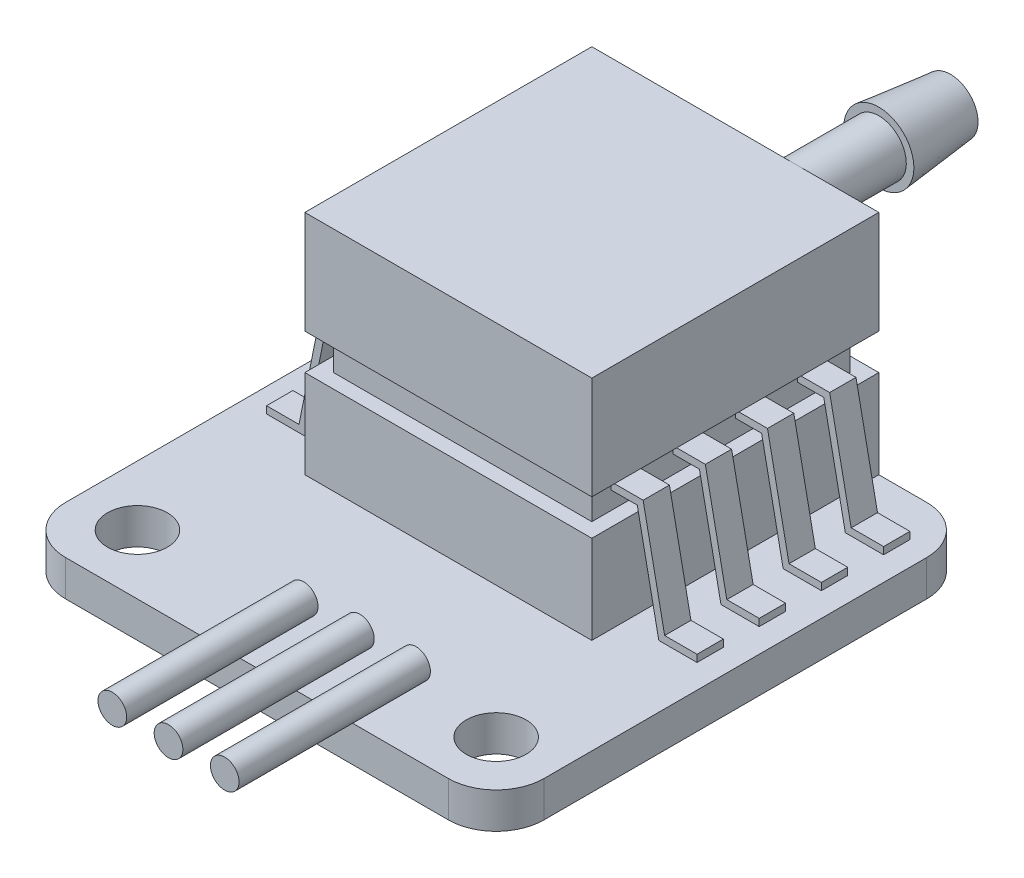
from build123d import *

# Parameters (mm, degrees)
SKETCH_1_R                = 1.25
EXTRUDE_1_DEPTH           = 1.5
SKETCH_2_W                = 12
SKETCH_2_H                = 12
EXTRUDE_2_DEPTH           = 9.5
CUT_EXTRUDE_START         = 3.7
SKETCH_3_OUTSIDE_W        = 28.07
SKETCH_3_OUTSIDE_H        = 28.07
SKETCH_3_OUTSIDE_W_2      = 10.8
SKETCH_3_OUTSIDE_H_2      = 10.8
CUT_EXTRUDE_1_DEPTH       = 1.5
SKETCH_4_R                = 1.15
SKETCH_4_R_2              = 0.6
EXTRUDE_3_DEPTH           = 6.5
SKETCH_5_R                = 1.15
SKETCH_5_R_2              = 0.6
EXTRUDE_4_DEPTH           = 3
EXTRUDE_4_DRAFT           = 6
EXTRUDE_4_PROFILE_2_DEPTH = 3
EXTRUDE_4_PROFILE_2_DRAFT = 6
EXTRUDE_START             = -1.7
EXTRUDE_1_2_DEPTH         = 1.1
PATTERN_LINEAR_1_COUNT    = 4
PATTERN_LINEAR_1_PITCH    = 2.6
EXTRUDE_5_DEPTH           = 5
EXTRUDE_5_DEPTH_BACK      = 3
SKETCH_7_R                = 0.6


with BuildPart() as part:
    # Эскиз1 → Extrude 1 (new body)
    with BuildSketch(Plane(origin=(0, 0, 0), x_dir=(1, 0, 0), z_dir=(0, 1, 0))):
        with BuildLine():
            Line((2, 0), (18, 0))
            ThreePointArc((18, 0), (19.414213562, 0.585786438), (20, 2))
            Line((20, 2), (20, 18))
            ThreePointArc((20, 18), (19.414213562, 19.414213562), (18, 20))
            Line((18, 20), (2, 20))
            ThreePointArc((2, 20), (0.585786438, 19.414213562), (0, 18))
            Line((0, 18), (0, 2))
            ThreePointArc((0, 2), (0.585786438, 0.585786438), (2, 0))
        make_face()
        with Locations(Location((2.5, 2.5, 0), (0, 0, 270))):
            Circle(SKETCH_1_R, mode=Mode.SUBTRACT)
        with Locations(Location((17.5, 2.5, 0), (0, 0, 270))):
            Circle(SKETCH_1_R, mode=Mode.SUBTRACT)
    extrude(amount=EXTRUDE_1_DEPTH)

    # Эскиз2 → Бобышка-Вытянуть2 (add)
    with BuildSketch(Plane(origin=(0, 1.5, 0), x_dir=(1, 0, 0), z_dir=(0, 1, 0))):
        with Locations((10, 14)):
            Rectangle(SKETCH_2_W, SKETCH_2_H)
    extrude(amount=EXTRUDE_2_DEPTH)

    # Эскиз3 outside → Вырез-Вытянуть1 (cut)
    with BuildSketch(Plane(origin=(0, 1.5, 0), x_dir=(1, 0, 0), z_dir=(0, 1, 0)).offset(CUT_EXTRUDE_START)):
        with Locations((10, 10)):
            Rectangle(SKETCH_3_OUTSIDE_W, SKETCH_3_OUTSIDE_H)
        with Locations((10, 14)):
            Rectangle(SKETCH_3_OUTSIDE_W_2, SKETCH_3_OUTSIDE_H_2, mode=Mode.SUBTRACT)
    extrude(amount=CUT_EXTRUDE_1_DEPTH, mode=Mode.SUBTRACT)

    # Эскиз4 → Бобышка-Вытянуть3 (add)
    # profile 1 of 2: a face of its own
    with BuildSketch(Plane(origin=(0, 0, -20), x_dir=(-1, 0, 0), z_dir=(0, 0, -1))):
        with Locations(Location((-12.5, 9.85, 0), (0, 0, 90))):
            Circle(SKETCH_4_R)
        with Locations((-12.5, 9.85)):
            Circle(SKETCH_4_R_2, mode=Mode.SUBTRACT)
    # profile 2 of 2: a face of its own
    with BuildSketch(Plane(origin=(0, 0, -20), x_dir=(-1, 0, 0), z_dir=(0, 0, -1))):
        with Locations(Location((-7.5, 2.65, 0), (0, 0, 180))):
            Circle(SKETCH_4_R)
        with Locations((-7.5, 2.65)):
            Circle(SKETCH_4_R_2, mode=Mode.SUBTRACT)
    extrude(amount=EXTRUDE_3_DEPTH)


with BuildPart() as extrude_4_tool:
    # Эскиз5 → Бобышка-Вытянуть4 (with draft: the straight prism first)
    with BuildSketch(Plane(origin=(0, 0, -26.5), x_dir=(-1, 0, 0), z_dir=(0, 0, -1))):
        with Locations(Location((-7.5, 2.65, 0), (0, 0, 180))):
            Circle(SKETCH_5_R)
        with Locations((-7.5, 2.65)):
            Circle(SKETCH_5_R_2, mode=Mode.SUBTRACT)
    extrude(amount=-EXTRUDE_4_DEPTH)
    # Бобышка-Вытянуть4: the draft: its side faces are tilted about the plane it starts from
    extrude_4_sides = [extrude_4_tool.faces().sort_by_distance(p)[0] for p in [
        (6.35, 2.65, -25),
        (8.1, 2.65, -25),
    ]]
    draft(extrude_4_sides, Plane(origin=(0, 0, -26.5), x_dir=(-1, 0, 0), z_dir=(0, 0, -1)), EXTRUDE_4_DRAFT)


with BuildPart() as part_1:
    add(part.part)

    # Бобышка-Вытянуть4: add extrude_4_tool
    add(extrude_4_tool.part)


with BuildPart() as extrude_4_profile_2_tool:
    # Эскиз5 → Бобышка-Вытянуть4 profile 2 (with draft: the straight prism first)
    with BuildSketch(Plane(origin=(0, 0, -26.5), x_dir=(-1, 0, 0), z_dir=(0, 0, -1))):
        with Locations(Location((-12.5, 9.85, 0), (0, 0, 90))):
            Circle(SKETCH_5_R)
        with Locations((-12.5, 9.85)):
            Circle(SKETCH_5_R_2, mode=Mode.SUBTRACT)
    extrude(amount=-EXTRUDE_4_PROFILE_2_DEPTH)
    # Бобышка-Вытянуть4 profile 2: the draft: its side faces are tilted about the plane it starts from
    extrude_4_profile_2_sides = [extrude_4_profile_2_tool.faces().sort_by_distance(p)[0] for p in [
        (12.5, 8.7, -25),
        (13.1, 9.85, -25),
    ]]
    draft(extrude_4_profile_2_sides, Plane(origin=(0, 0, -26.5), x_dir=(-1, 0, 0), z_dir=(0, 0, -1)), EXTRUDE_4_PROFILE_2_DRAFT)


with BuildPart() as part_2:
    add(part_1.part)

    # Бобышка-Вытянуть4 profile 2: add extrude_4_profile_2_tool
    add(extrude_4_profile_2_tool.part)

    # Эскиз6 → Extrude 1 2 (add)
    with BuildSketch(Plane(origin=(0, 0, -20), x_dir=(-1, 0, 0), z_dir=(0, 0, -1)).offset(EXTRUDE_START)):
        Polygon((-15.4, 5.95), (-16.5, 5.95), (-17.4, 1.5), (-19, 1.5), (-19, 1.8), (-17.645399941, 1.8), (-16.745399941, 6.25), (-15.4, 6.25), align=None)
        Polygon((-1, 1.5), (-2.6, 1.5), (-3.5, 5.95), (-4.6, 5.95), (-4.6, 6.25), (-3.254600059, 6.25), (-2.354600059, 1.8), (-1, 1.8), align=None)
    extrude_1_2 = extrude(amount=-EXTRUDE_1_2_DEPTH)

    # Линейный массив1: Extrude 1 2 ×4
    with Locations(*[(0, 0, i * PATTERN_LINEAR_1_PITCH) for i in range(1, PATTERN_LINEAR_1_COUNT)]):
        add(extrude_1_2)

    # Эскиз7 → Бобышка-Вытянуть5 (add, two sides: drawn at the far end of the back side and taken through both)
    with BuildSketch(Plane.XY.offset(-EXTRUDE_5_DEPTH_BACK)):
        with Locations((8.95, 2)):
            Circle(SKETCH_7_R)
        with Locations((11.3, 2)):
            Circle(SKETCH_7_R)
        with Locations((13.65, 2)):
            Circle(SKETCH_7_R)
    extrude(amount=EXTRUDE_5_DEPTH + EXTRUDE_5_DEPTH_BACK)


solid = part_2.part
